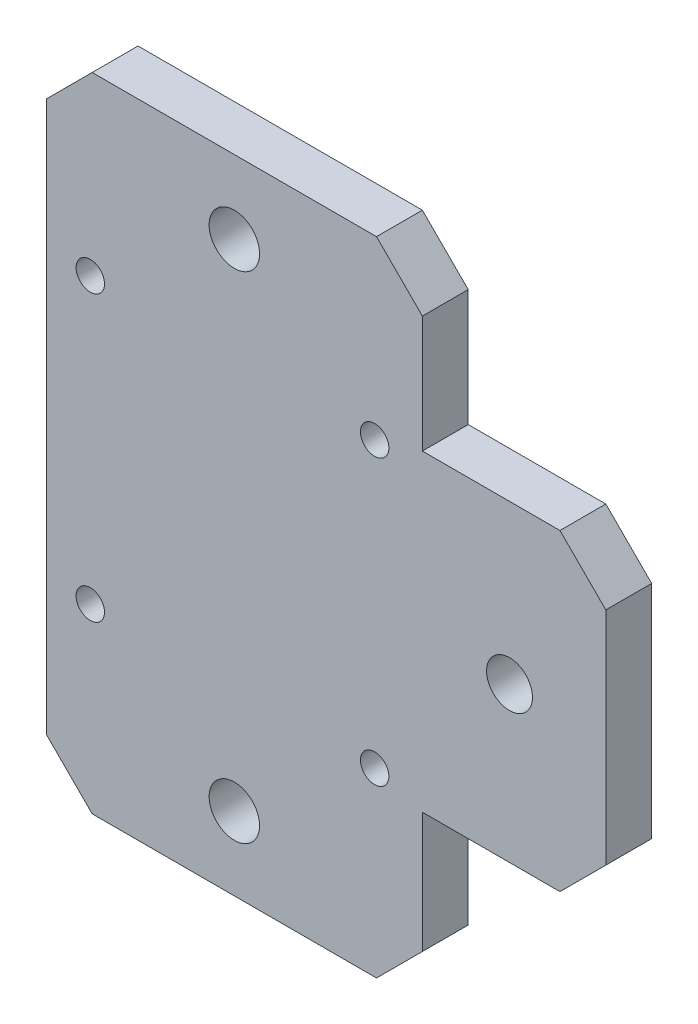
from build123d import *

# Parameters (mm, degrees)
SKETCH1_W           = 41
SKETCH1_H           = 70
SKETCH1_R           = 1.55
SKETCH1_R_2         = 2.75
BOSS_EXTRUDE1_DEPTH = 5
CHAMFER1_SIZE       = 5
SKETCH2_W           = 20
SKETCH2_H           = 34.1
SKETCH2_R           = 2.5
BOSS_EXTRUDE2_DEPTH = 5
CHAMFER2_SIZE       = 5


with BuildPart() as part:
    # Sketch1 → Boss-Extrude1 (new body)
    with BuildSketch(Plane.XY):
        Rectangle(SKETCH1_W, SKETCH1_H)
        with Locations((-15.704778157, -15.295221843)):
            Circle(SKETCH1_R, mode=Mode.SUBTRACT)
        with Locations((15.295221843, -15.295221843)):
            Circle(SKETCH1_R, mode=Mode.SUBTRACT)
        with Locations((15.295221843, 15.704778157)):
            Circle(SKETCH1_R, mode=Mode.SUBTRACT)
        with Locations((-15.704778157, 15.704778157)):
            Circle(SKETCH1_R, mode=Mode.SUBTRACT)
        with Locations((0, 27)):
            Circle(SKETCH1_R_2, mode=Mode.SUBTRACT)
        with Locations((0, -27)):
            Circle(SKETCH1_R_2, mode=Mode.SUBTRACT)
    extrude(amount=BOSS_EXTRUDE1_DEPTH)

    # Chamfer1
    chamfer1_edges = [part.edges().sort_by_distance(p)[0] for p in [
        (-20.5, 35, 2.5),
        (20.5, 35, 2.5),
        (20.5, -35, 2.5),
        (-20.5, -35, 2.5),
    ]]
    chamfer(chamfer1_edges, length=CHAMFER1_SIZE)

    # Sketch2 → Boss-Extrude2 (add)
    with BuildSketch(Plane.XY.offset(5)):
        with Locations((30.5, 0.204778157)):
            Rectangle(SKETCH2_W, SKETCH2_H)
        with Locations((30, 0)):
            Circle(SKETCH2_R, mode=Mode.SUBTRACT)
    extrude(amount=-BOSS_EXTRUDE2_DEPTH)

    # Chamfer2
    chamfer2_edges = [part.edges().sort_by_distance(p)[0] for p in [
        (40.5, 17.254778157, 2.5),
        (40.5, -16.845221843, 2.5),
    ]]
    chamfer(chamfer2_edges, length=CHAMFER2_SIZE)


solid = part.part
